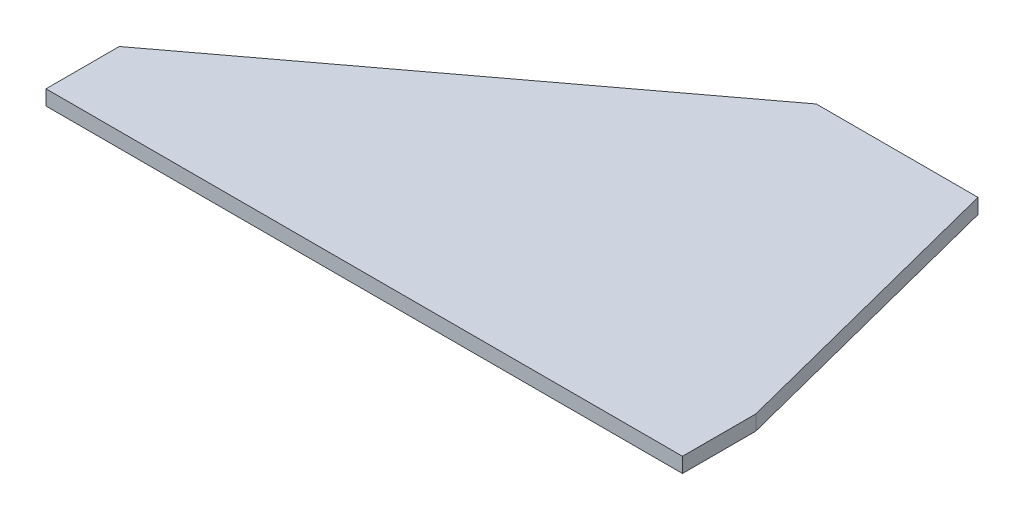
from build123d import *

# Parameters (mm, degrees)
BOSS_EXTRUDE1_DEPTH      = 2.38125
BOSS_EXTRUDE1_DEPTH_BACK = 2.38125


with BuildPart() as part:
    # Sketch1 → Boss-Extrude1 (new, two sides: drawn at the far end of the back side and taken through both)
    with BuildSketch(Plane(origin=(0, 0, 0), x_dir=(1, 0, 0), z_dir=(0, 1, 0)).offset(-BOSS_EXTRUDE1_DEPTH_BACK)):
        Polygon((0, 0), (0, 23.368), (127, 118.618), (178.562, 118.618), (202.946, 23.368), (202.946, 0), align=None)
    extrude(amount=BOSS_EXTRUDE1_DEPTH + BOSS_EXTRUDE1_DEPTH_BACK)


solid = part.part
